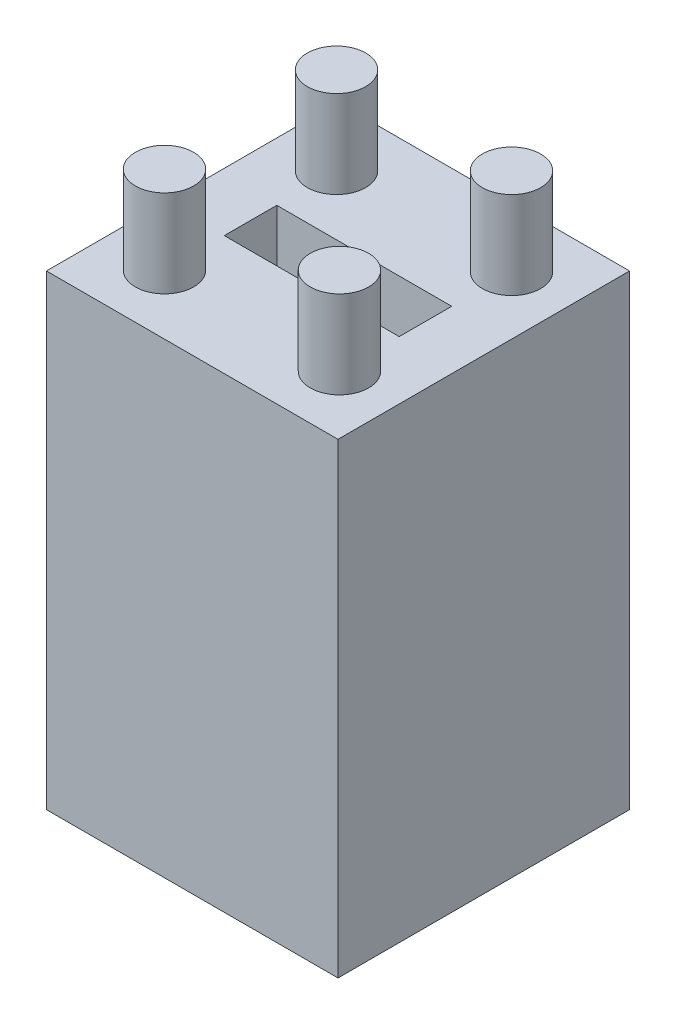
from build123d import *

# Parameters (mm, degrees)
SKETCH1_W           = 63.5
SKETCH1_H           = 63.5
BOSS_EXTRUDE1_DEPTH = 101.6
SKETCH3_W           = 38.1
SKETCH3_H           = 11.43
CUT_EXTRUDE1_DEPTH  = 112.079633597
SKETCH5_R           = 6.35
BOSS_EXTRUDE2_DEPTH = 19.05
SKETCH6_R           = 6.858
CUT_EXTRUDE3_DEPTH  = 19.05


with BuildPart() as part:
    # Sketch1 → Boss-Extrude1 (new body)
    with BuildSketch(Plane(origin=(0, 0, 0), x_dir=(1, 0, 0), z_dir=(0, 1, 0))):
        Rectangle(SKETCH1_W, SKETCH1_H)
    extrude(amount=BOSS_EXTRUDE1_DEPTH)

    # Sketch3 → Cut-Extrude1 (cut, through all)
    with BuildSketch(Plane(origin=(0, 101.6, 0), x_dir=(1, 0, 0), z_dir=(0, 1, 0))):
        Rectangle(SKETCH3_W, SKETCH3_H)
    extrude(amount=-CUT_EXTRUDE1_DEPTH, mode=Mode.SUBTRACT)

    # Sketch5 → Boss-Extrude2 (add)
    with BuildSketch(Plane(origin=(0, 101.6, 0), x_dir=(1, 0, 0), z_dir=(0, 1, 0))):
        with Locations(Location((19.05, -18.7325, 0), (0, 0, 90))):
            Circle(SKETCH5_R)
        with Locations(Location((-19.05, -18.7325, 0), (0, 0, 90))):
            Circle(SKETCH5_R)
        with Locations(Location((-19.05, 18.7325, 0), (0, 0, 90))):
            Circle(SKETCH5_R)
        with Locations(Location((19.05, 18.7325, 0), (0, 0, 90))):
            Circle(SKETCH5_R)
    extrude(amount=BOSS_EXTRUDE2_DEPTH)

    # Sketch6 → Cut-Extrude3 (cut)
    with BuildSketch(Plane.XZ):
        with Locations(Location((18.542, -18.796, 0), (0, 0, 270))):
            Circle(SKETCH6_R)
        with Locations(Location((-18.542, -18.796, 0), (0, 0, 270))):
            Circle(SKETCH6_R)
        with Locations(Location((-18.542, 18.669, 0), (0, 0, 270))):
            Circle(SKETCH6_R)
        with Locations(Location((18.542, 18.669, 0), (0, 0, 270))):
            Circle(SKETCH6_R)
    extrude(amount=-CUT_EXTRUDE3_DEPTH, mode=Mode.SUBTRACT)


solid = part.part
